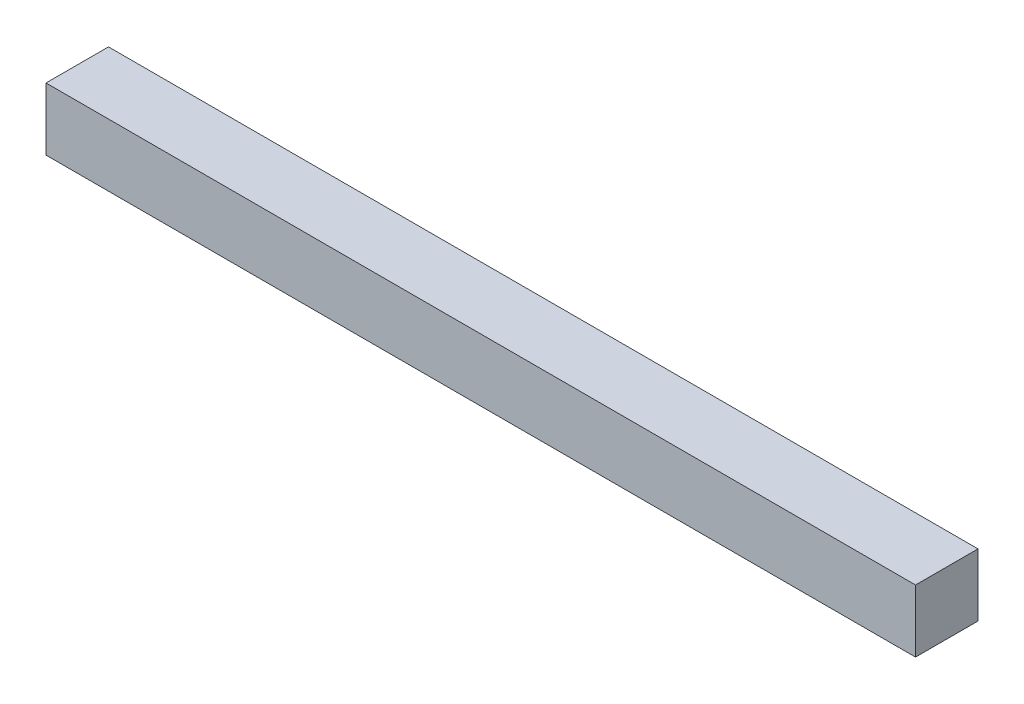
from build123d import *

# Parameters (mm, degrees)
SKETCH_1_W      = 23
SKETCH_1_H      = 23
EXTRUDE_1_DEPTH = 320


with BuildPart() as part:
    # Эскиз1 → Бобышка-Вытянуть1 (new body)
    with BuildSketch(Plane(origin=(0, 0, 0), x_dir=(0, 0, -1), z_dir=(1, 0, 0))):
        with Locations((-5.875496584, 0.737565549)):
            Rectangle(SKETCH_1_W, SKETCH_1_H)
    extrude(amount=EXTRUDE_1_DEPTH)


solid = part.part
